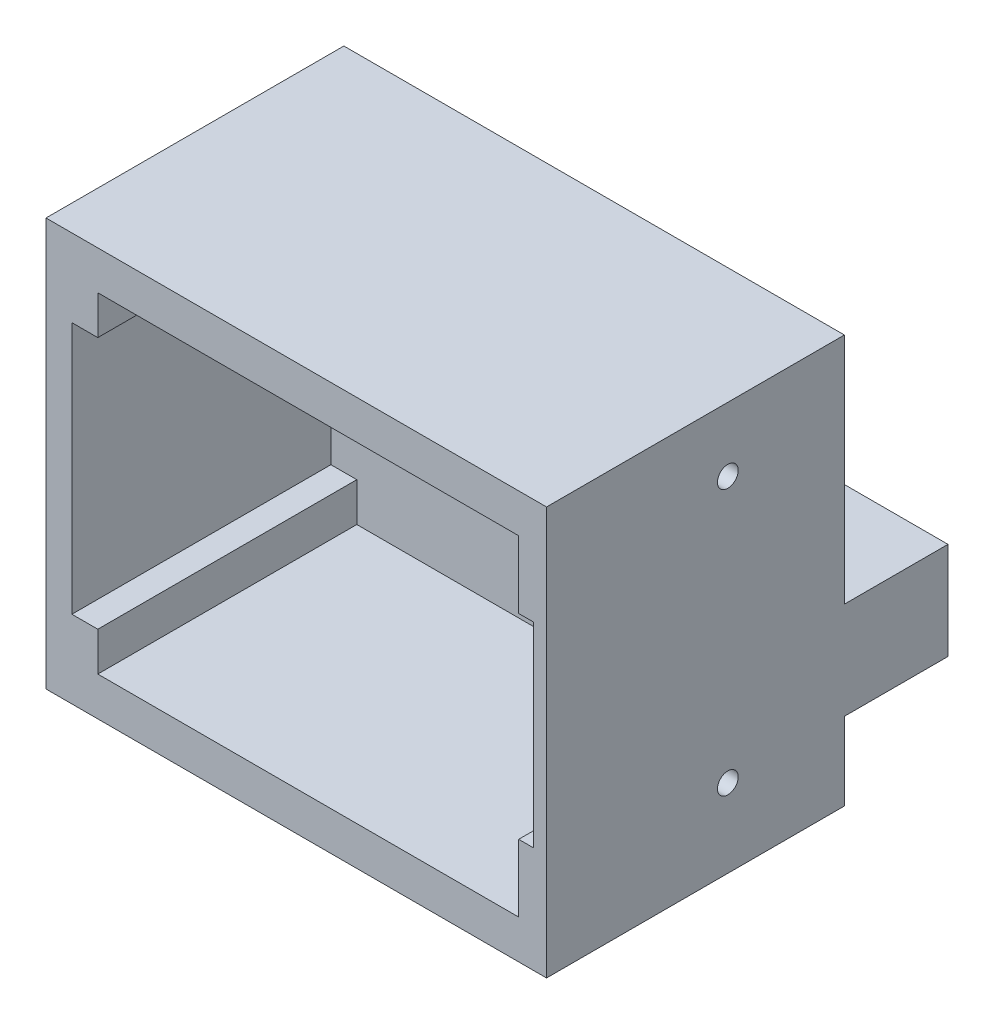
from build123d import *

# Parameters (mm, degrees)
SKETCH1_W           = 38.65
SKETCH1_H           = 23
BOSS_EXTRUDE1_DEPTH = 31.5
CUT_EXTRUDE1_DEPTH  = 20
SKETCH4_R           = 0.8
CUT_EXTRUDE2_DEPTH  = 2.15
BOSS_EXTRUDE2_START = -6
SKETCH6_W           = 37.65
SKETCH6_H           = 8
SKETCH6_R           = 1.5
SKETCH6_W_2         = 1
BOSS_EXTRUDE2_DEPTH = 7.5


with BuildPart() as part:
    # Sketch1 → Boss-Extrude1 (new body)
    with BuildSketch(Plane(origin=(0, 0, 0), x_dir=(1, 0, 0), z_dir=(0, 1, 0))):
        with Locations((19.325, 11.5)):
            Rectangle(SKETCH1_W, SKETCH1_H)
    extrude(amount=BOSS_EXTRUDE1_DEPTH)

    # Sketch3 → Cut-Extrude1 (cut)
    with BuildSketch(Plane.XY):
        Polygon((2, 25.5), (2, 6), (4, 6), (4, 3), (36.5, 3), (36.5, 8.2), (37.65, 8.2), (37.65, 23.3), (36.5, 23.3), (36.5, 28.5), (4, 28.5), (4, 25.5), align=None)
    extrude(amount=-CUT_EXTRUDE1_DEPTH, mode=Mode.SUBTRACT)

    # Sketch4 → Cut-Extrude2 (cut)
    with BuildSketch(Plane.ZY.offset(-36.5)):
        with Locations((-14, 26.55)):
            Circle(SKETCH4_R)
        with Locations((-14, 6.05)):
            Circle(SKETCH4_R)
    extrude(amount=-CUT_EXTRUDE2_DEPTH, mode=Mode.SUBTRACT)

    # Sketch6 → Boss-Extrude2 (add)
    # profile 1 of 2: a face of its own
    with BuildSketch(Plane.XZ.offset(BOSS_EXTRUDE2_START)):
        with Locations((18.825, -27)):
            Rectangle(SKETCH6_W, SKETCH6_H)
        with Locations(Location((8, -27, 0), (0, 0, 270))):
            Circle(SKETCH6_R, mode=Mode.SUBTRACT)
        with Locations(Location((29.65, -27, 0), (0, 0, 270))):
            Circle(SKETCH6_R, mode=Mode.SUBTRACT)
    # profile 2 of 2: a face of its own
    with BuildSketch(Plane.XZ.offset(BOSS_EXTRUDE2_START)):
        with Locations((38.15, -27)):
            Rectangle(SKETCH6_W_2, SKETCH6_H)
    extrude(amount=-BOSS_EXTRUDE2_DEPTH)


solid = part.part
